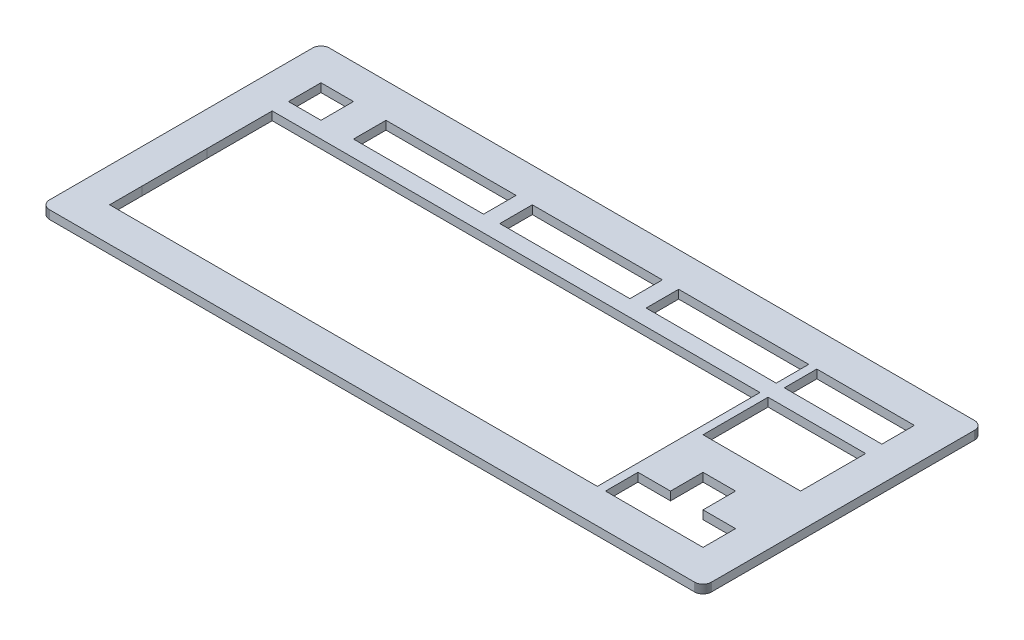
from build123d import *

# Parameters (mm, degrees)
SKETCH2_W           = 57.153
SKETCH2_H           = 38.1011
SKETCH2_H_2         = 19.05
SKETCH2_W_2         = 76.202
SKETCH2_W_3         = 76.203
SKETCH2_W_4         = 76.2019
SKETCH2_W_5         = 19.0499
BOSS_EXTRUDE1_DEPTH = 5


with BuildPart() as part:
    # Sketch2 → Boss-Extrude1 (new body)
    with BuildSketch(Plane(origin=(0, 0, 0), x_dir=(1, 0, 0), z_dir=(0, 1, 0))):
        Polygon((382.958, 164.299), (383.35, 164.284), (383.741, 164.237), (384.126, 164.162), (384.503, 164.055), (384.87, 163.919), (385.226, 163.755), (385.572, 163.564), (385.897, 163.344), (386.203, 163.102), (386.493, 162.834), (386.761, 162.547), (387.004, 162.238), (387.223, 161.913), (387.414, 161.569), (387.576, 161.212), (387.713, 160.845), (387.819, 160.467), (387.897, 160.082), (387.943, 159.693), (387.96, 159.299), (387.96, 5.27237), (387.943, 4.881), (387.897, 4.49104), (387.819, 4.10655), (387.713, 3.72759), (387.576, 3.35966), (387.414, 3.00412), (387.223, 2.66099), (387.004, 2.3344), (386.761, 2.02572), (386.493, 1.73771), (386.203, 1.47037), (385.897, 1.22783), (385.572, 1.0101), (385.226, 0.818554), (384.87, 0.654569), (384.503, 0.518142), (384.126, 0.412034), (383.741, 0.334863), (383.35, 0.289388), (382.958, 0.272852), (5.09598, 0.272852), (4.70186, 0.289388), (4.3119, 0.334863), (3.9274, 0.412034), (3.54983, 0.518142), (3.18189, 0.654569), (2.82498, 0.818554), (2.48185, 1.0101), (2.15663, 1.22783), (1.84795, 1.47037), (1.55994, 1.73771), (1.2926, 2.02572), (1.05006, 2.3344), (0.830957, 2.66099), (0.63941, 3.00412), (0.475424, 3.35966), (0.338998, 3.72759), (0.232888, 4.10655), (0.157097, 4.49104), (0.110243, 4.881), (0.0950846, 5.27375), (0.0950846, 159.299), (0.110243, 159.693), (0.157097, 160.082), (0.232888, 160.467), (0.338998, 160.845), (0.475424, 161.212), (0.63941, 161.569), (0.830957, 161.913), (1.05006, 162.238), (1.2926, 162.547), (1.55994, 162.834), (1.84795, 163.102), (2.15663, 163.344), (2.48185, 163.564), (2.82498, 163.755), (3.18189, 163.919), (3.54983, 164.055), (3.9274, 164.162), (4.3119, 164.237), (4.70186, 164.284), (5.09598, 164.299), align=None)
        Polygon((329.756, 58.4743), (329.756, 39.4243), (310.706, 39.4243), (310.706, 20.3729), (367.859, 20.3729), (367.859, 39.4243), (348.809, 39.4243), (348.809, 58.4743), align=None, mode=Mode.SUBTRACT)
        Polygon((20.1952, 115.624), (20.1952, 77.5243), (20.1938, 77.5243), (20.1938, 39.4229), (20.1952, 39.4229), (20.1952, 20.3729), (305.947, 20.3729), (305.947, 115.624), align=None, mode=Mode.SUBTRACT)
        with Locations((339.2825, 96.57345)):
            Rectangle(SKETCH2_W, SKETCH2_H, mode=Mode.SUBTRACT)
        with Locations((339.2825, 134.674)):
            Rectangle(SKETCH2_W, SKETCH2_H_2, mode=Mode.SUBTRACT)
        with Locations((267.846, 134.674)):
            Rectangle(SKETCH2_W_2, SKETCH2_H_2, mode=Mode.SUBTRACT)
        with Locations((182.1205, 134.674)):
            Rectangle(SKETCH2_W_3, SKETCH2_H_2, mode=Mode.SUBTRACT)
        with Locations((96.39605, 134.674)):
            Rectangle(SKETCH2_W_4, SKETCH2_H_2, mode=Mode.SUBTRACT)
        with Locations((29.72015, 134.674)):
            Rectangle(SKETCH2_W_5, SKETCH2_H_2, mode=Mode.SUBTRACT)
    extrude(amount=BOSS_EXTRUDE1_DEPTH)


solid = part.part
